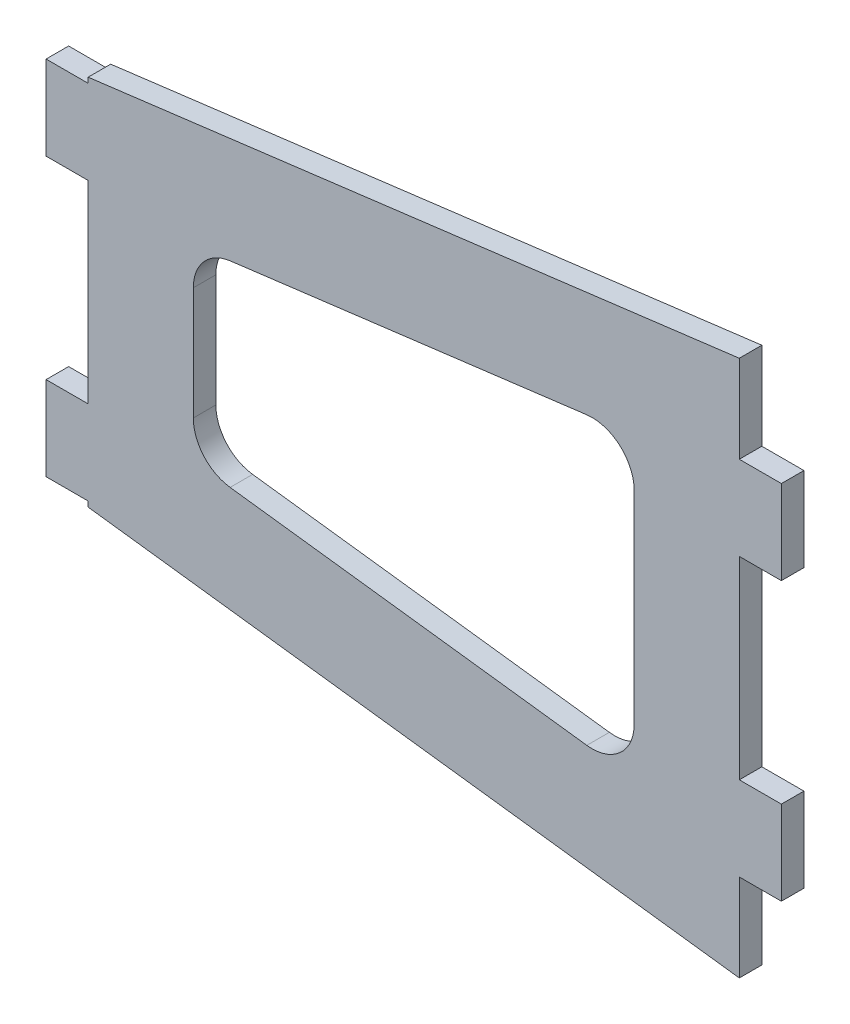
from build123d import *

# Parameters (mm, degrees)
BOSS_EXTRUDE1_DEPTH = 3.4036


with BuildPart() as part:
    # Sketch1 → Boss-Extrude1 (new body)
    with BuildSketch(Plane.XY):
        Polygon((8672.177263948, 2928.441804612), (8678.527263948, 2928.441804612), (8678.527263948, 2941.141804612), (8672.177263948, 2941.141804612), (8672.177263948, 2970.351804612), (8678.527263948, 2970.351804612), (8678.527263948, 2983.051804612), (8672.177263948, 2983.051804612), (8672.177263948, 2996.259804612), (8573.879263948, 2983.853260922), (8573.879263948, 2983.051804612), (8567.529263948, 2983.051804612), (8567.529263948, 2970.351804612), (8573.879263948, 2970.351804612), (8573.879263948, 2941.141804612), (8567.529263948, 2941.141804612), (8567.529263948, 2928.441804612), (8573.879263948, 2928.441804612), (8573.879263948, 2927.640348301), (8672.177263948, 2915.233804612), align=None)
        with BuildLine():
            Line((8589.754263948, 2964.257036739), (8589.754263948, 2947.236572484))
            ThreePointArc((8589.754263948, 2947.236572484), (8591.34129796, 2943.036970717), (8595.309115917, 2940.936553468))
            Line((8595.309115917, 2940.936553468), (8649.157115917, 2934.140203953))
            ThreePointArc((8649.157115917, 2934.140203953), (8654.151865715, 2935.677256982), (8656.302263948, 2940.44022297))
            Line((8656.302263948, 2940.44022297), (8656.302263948, 2971.053386254))
            ThreePointArc((8656.302263948, 2971.053386254), (8654.151865715, 2975.816352241), (8649.157115917, 2977.35340527))
            Line((8649.157115917, 2977.35340527), (8595.309115917, 2970.557055756))
            ThreePointArc((8595.309115917, 2970.557055756), (8591.34129796, 2968.456638506), (8589.754263948, 2964.257036739))
        make_face(mode=Mode.SUBTRACT)
    extrude(amount=BOSS_EXTRUDE1_DEPTH)


solid = part.part
